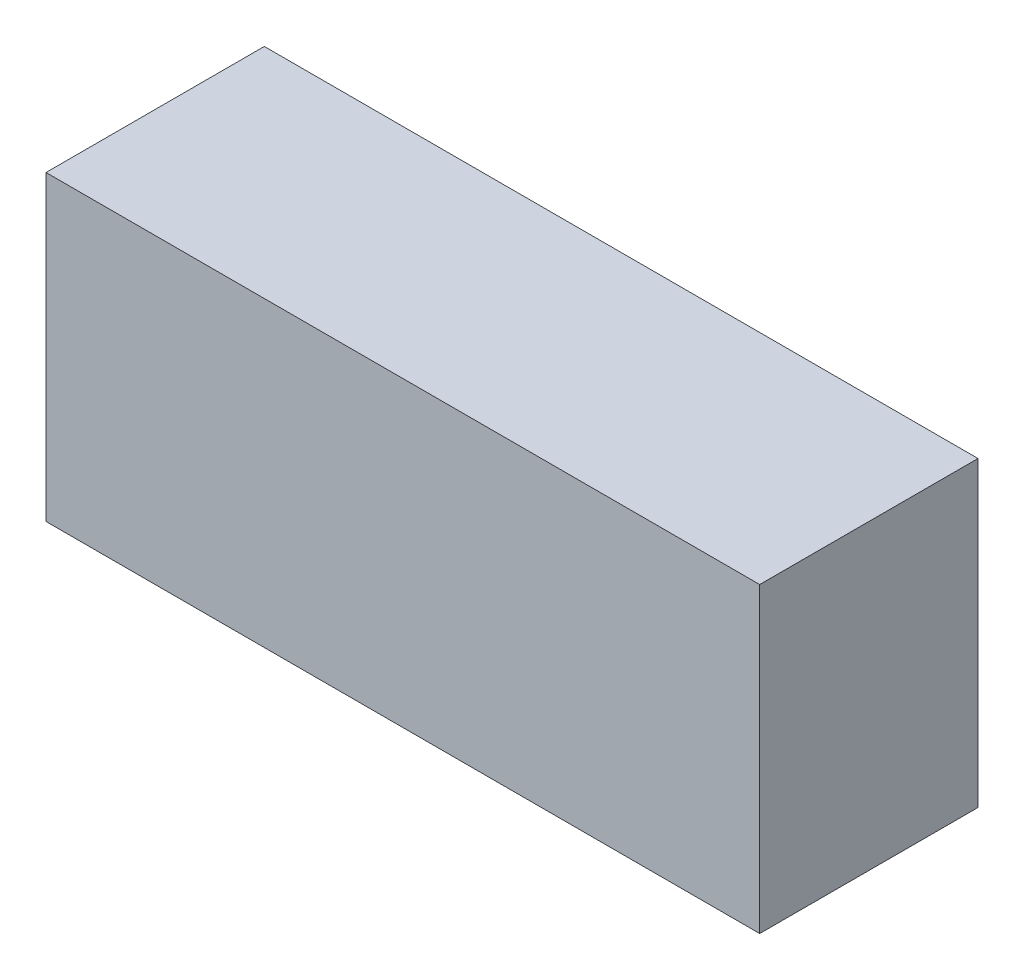
from build123d import *

# Parameters (mm, degrees)
SKETCH_1_W              = 4.25
SKETCH_1_H              = 1.8
COMPONENT_OUTLINE_DEPTH = 1.3


with BuildPart() as part:
    # 草图1 → Component_Outline (new body)
    with BuildSketch(Plane.XY):
        Rectangle(SKETCH_1_W, SKETCH_1_H)
    extrude(amount=COMPONENT_OUTLINE_DEPTH)


solid = part.part
